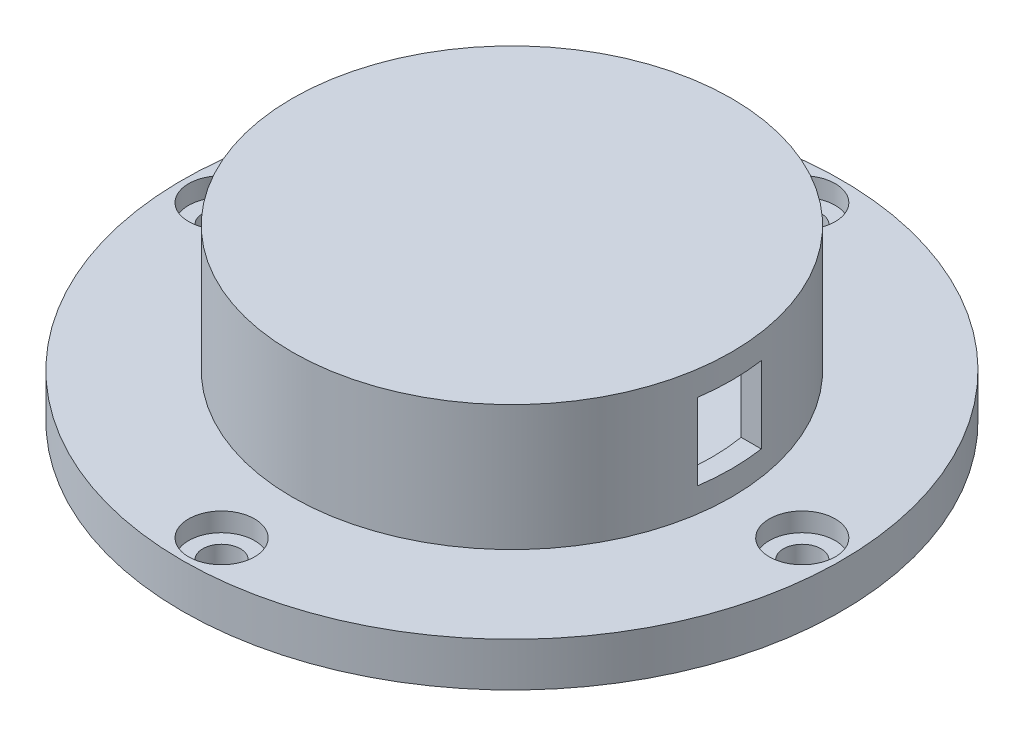
from build123d import *

# Parameters (mm, degrees)
SKETCH1_R           = 52.5
BOSS_EXTRUDE1_DEPTH = 7
SKETCH2_R           = 35
SKETCH2_R_2         = 31.83
BOSS_EXTRUDE3_DEPTH = 20
SKETCH3_R           = 3
CUT_EXTRUDE1_DEPTH  = 20
SKETCH4_R           = 5.25
CUT_EXTRUDE2_DEPTH  = 3
SKETCH5_W           = 10.2
SKETCH5_H           = 12.2
CUT_EXTRUDE3_DEPTH  = 120
BOSS_EXTRUDE4_START = -3
SKETCH6_R           = 31.83
BOSS_EXTRUDE4_DEPTH = 3


with BuildPart() as part:
    # Sketch1 → Boss-Extrude1 (new body)
    with BuildSketch(Plane(origin=(0, 0, 0), x_dir=(1, 0, 0), z_dir=(0, 1, 0))):
        with Locations(Location((0, 0, 0), (0, 0, 270))):
            Circle(SKETCH1_R)
    extrude(amount=BOSS_EXTRUDE1_DEPTH)

    # Sketch2 → Boss-Extrude3 (add)
    with BuildSketch(Plane(origin=(0, 7, 0), x_dir=(1, 0, 0), z_dir=(0, 1, 0))):
        with Locations(Location((0, 0, 0), (0, 0, 270))):
            Circle(SKETCH2_R)
        with Locations(Location((0, 0, 0), (0, 0, 270))):
            Circle(SKETCH2_R_2, mode=Mode.SUBTRACT)
    extrude(amount=BOSS_EXTRUDE3_DEPTH)

    # Sketch3 → Cut-Extrude1 (cut)
    with BuildSketch(Plane(origin=(0, 7, 0), x_dir=(1, 0, 0), z_dir=(0, 1, 0))):
        with Locations(Location((0, 46.25, 0), (0, 0, 270))):
            Circle(SKETCH3_R)
        with Locations(Location((46.25, 0, 0), (0, 0, 270))):
            Circle(SKETCH3_R)
        with Locations(Location((0, -46.25, 0), (0, 0, 270))):
            Circle(SKETCH3_R)
        with Locations(Location((-46.25, 0, 0), (0, 0, 270))):
            Circle(SKETCH3_R)
    extrude(amount=-CUT_EXTRUDE1_DEPTH, mode=Mode.SUBTRACT)

    # Sketch4 → Cut-Extrude2 (cut)
    with BuildSketch(Plane(origin=(0, 7, 0), x_dir=(1, 0, 0), z_dir=(0, 1, 0))):
        with Locations(Location((0, 46.25, 0), (0, 0, 270))):
            Circle(SKETCH4_R)
        with Locations(Location((46.25, 0, 0), (0, 0, 270))):
            Circle(SKETCH4_R)
        with Locations(Location((0, -46.25, 0), (0, 0, 270))):
            Circle(SKETCH4_R)
        with Locations(Location((-46.25, 0, 0), (0, 0, 270))):
            Circle(SKETCH4_R)
    extrude(amount=-CUT_EXTRUDE2_DEPTH, mode=Mode.SUBTRACT)

    # Sketch5 → Cut-Extrude3 (cut)
    with BuildSketch(Plane(origin=(60, 0, 0), x_dir=(0, 0, -1), z_dir=(1, 0, 0))):
        with Locations((0, 17)):
            Rectangle(SKETCH5_W, SKETCH5_H)
    extrude(amount=-CUT_EXTRUDE3_DEPTH, mode=Mode.SUBTRACT)

    # Sketch6 → Boss-Extrude4 (add)
    with BuildSketch(Plane(origin=(0, 27, 0), x_dir=(1, 0, 0), z_dir=(0, 1, 0)).offset(BOSS_EXTRUDE4_START)):
        with Locations(Location((0, 0, 0), (0, 0, 270))):
            Circle(SKETCH6_R)
    extrude(amount=BOSS_EXTRUDE4_DEPTH)


solid = part.part
